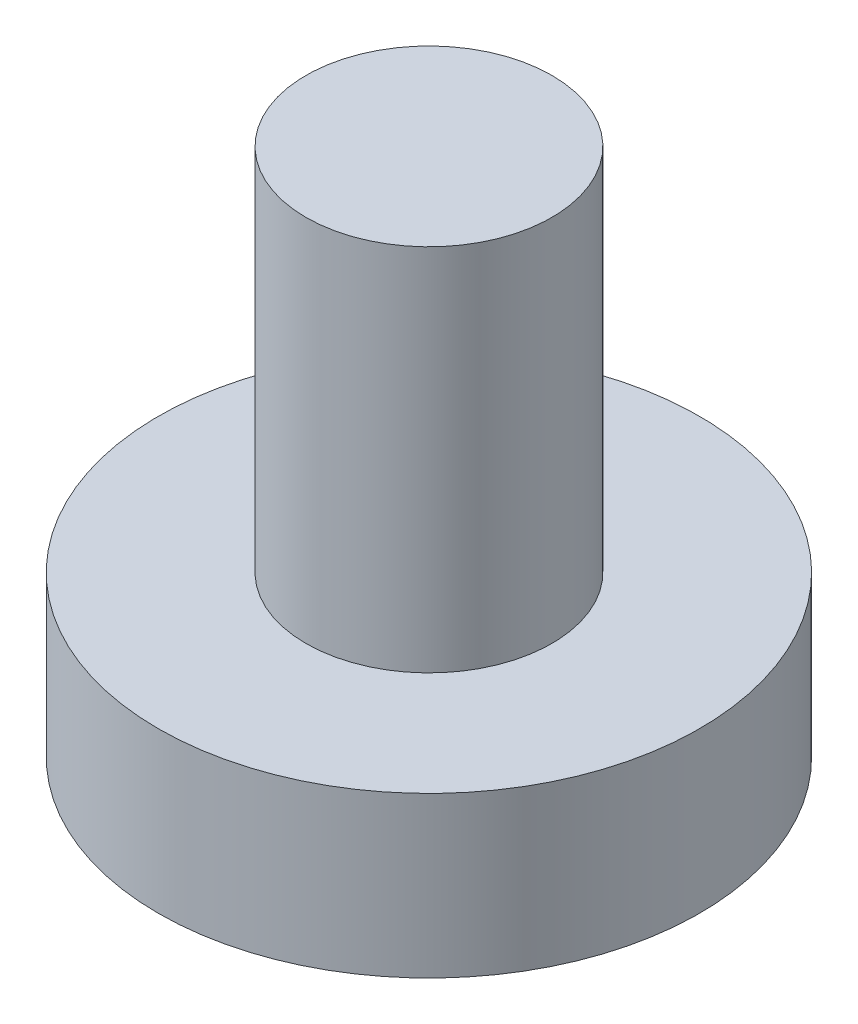
from build123d import *

# Parameters (mm, degrees)
SKETCH_1_R          = 2.2
EXTRUDE_1_DEPTH     = 1.3
CUT_EXTRUDE_1_DEPTH = 0.6
SKETCH_2_R          = 1
EXTRUDE_2_DEPTH     = 3


with BuildPart() as part:
    # 草图1 → 凸台-拉伸1 (new body)
    with BuildSketch(Plane(origin=(0, 0, 0), x_dir=(1, 0, 0), z_dir=(0, 1, 0))):
        Circle(SKETCH_1_R)
    extrude(amount=EXTRUDE_1_DEPTH)

    # 草图1<3> → 切除-拉伸1 (cut)
    with BuildSketch(Plane(origin=(0, 0, 0), x_dir=(1, 0, 0), z_dir=(0, 1, 0))):
        Polygon((0.577350269, -1), (1.154700538, 0), (0.577350269, 1), (-0.577350269, 1), (-1.154700538, 0), (-0.577350269, -1), align=None)
    extrude(amount=CUT_EXTRUDE_1_DEPTH, mode=Mode.SUBTRACT)

    # 草图2 → 凸台-拉伸2 (add)
    with BuildSketch(Plane(origin=(0, 1.3, 0), x_dir=(1, 0, 0), z_dir=(0, 1, 0))):
        Circle(SKETCH_2_R)
    extrude(amount=EXTRUDE_2_DEPTH)


solid = part.part
